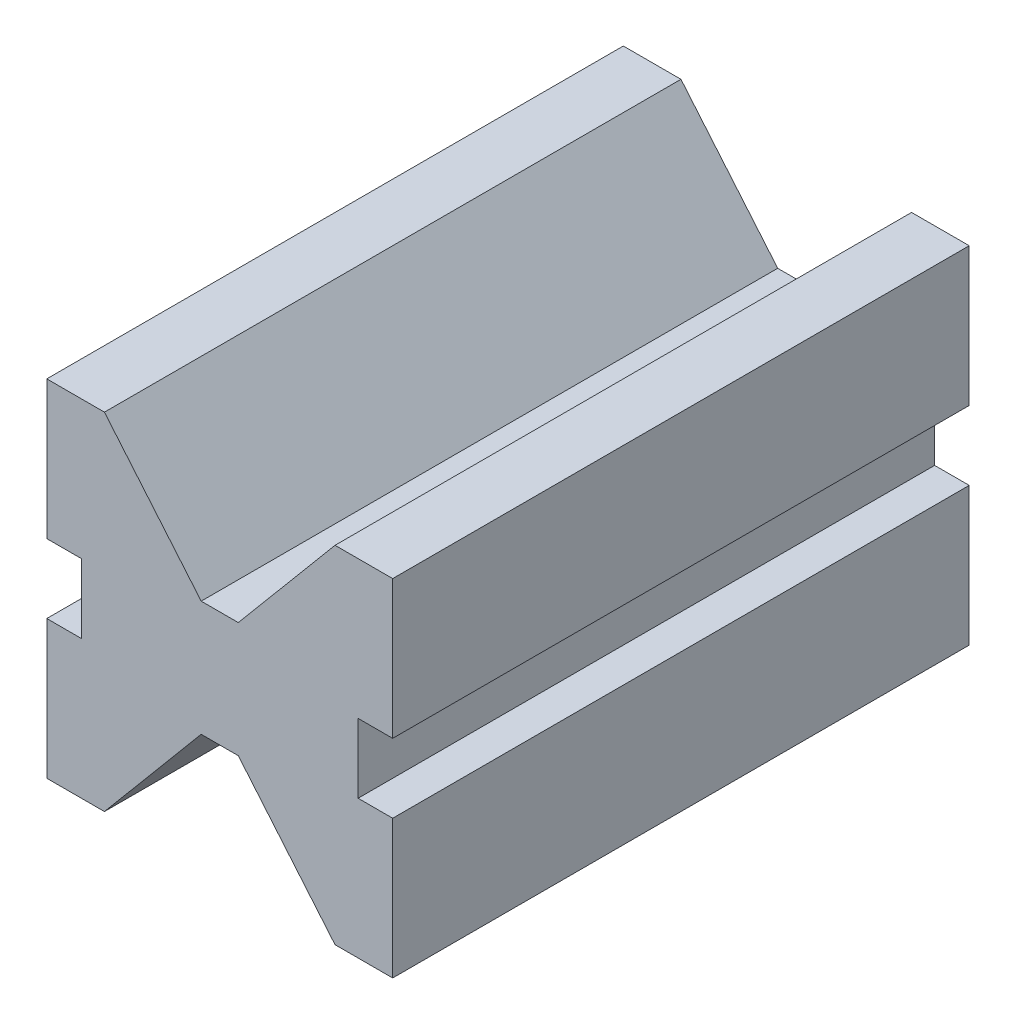
from build123d import *

# Parameters (mm, degrees)
BOSS_EXTRUDE1_DEPTH = 100


with BuildPart() as part:
    # Sketch2 → Boss-Extrude1 (new body)
    with BuildSketch(Plane.XY):
        Polygon((0, 0), (10, 0), (26.781992624, 20), (33.218007376, 20), (50, 0), (60, 0), (60, 24), (54, 24), (54, 36), (60, 36), (60, 60), (50, 60), (33.218007376, 40), (26.781992624, 40), (10, 60), (0, 60), (0, 36), (6, 36), (6, 24), (0, 24), align=None)
    extrude(amount=-BOSS_EXTRUDE1_DEPTH)


solid = part.part
